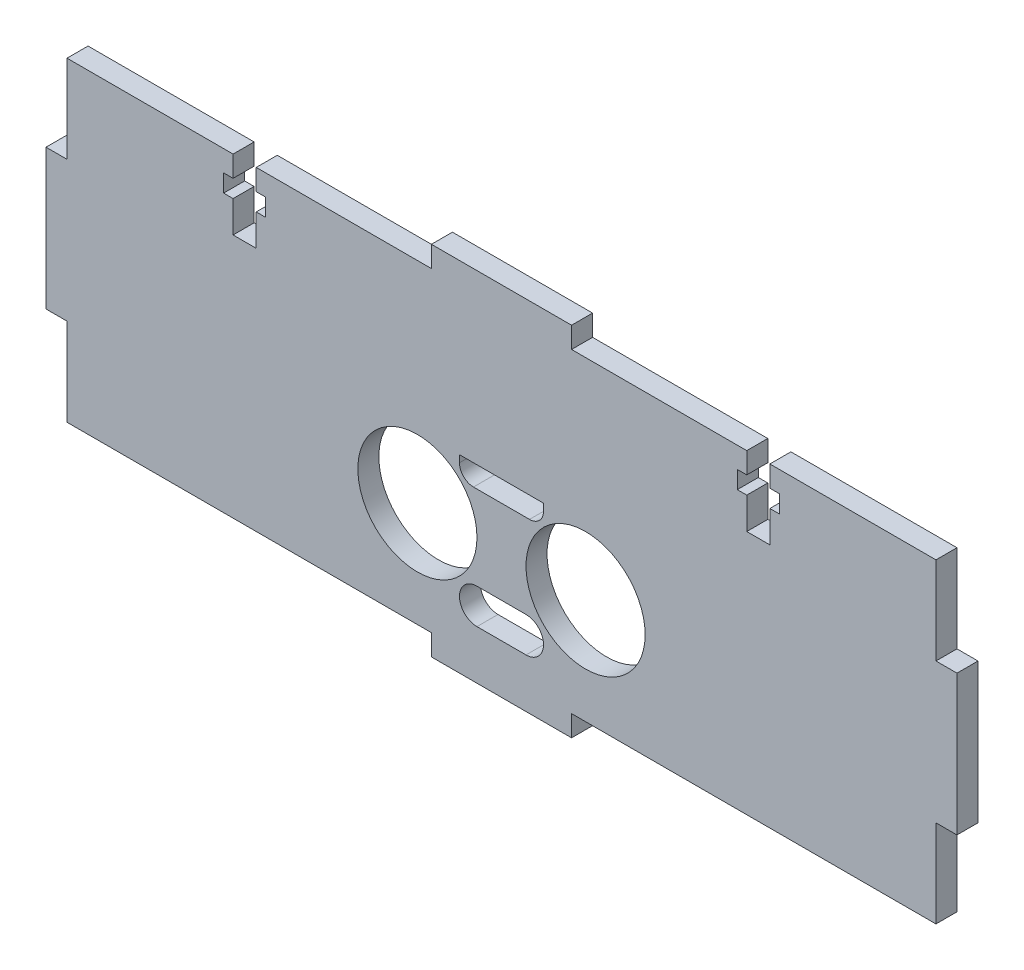
from build123d import *

# Parameters (mm, degrees)
SKETCH1_R           = 8.5
BOSS_EXTRUDE1_DEPTH = 3


with BuildPart() as part:
    # Sketch1 → Boss-Extrude1 (new body)
    with BuildSketch(Plane.XY):
        Polygon((10, -22.5), (62, -22.5), (62, -10), (65, -10), (65, 10), (62, 10), (62, 22.5), (38.3, 22.5), (38.3, 19.5), (39.65, 19.5), (39.65, 17), (38.3, 17), (38.3, 12.5), (35, 12.5), (35, 17), (33.65, 17), (33.65, 19.5), (35, 19.5), (35, 22.5), (10, 22.5), (10, 25.5), (-10, 25.5), (-10, 22.5), (-35, 22.5), (-35, 19.5), (-33.65, 19.5), (-33.65, 17), (-35, 17), (-35, 12.5), (-38.3, 12.5), (-38.3, 17), (-39.65, 17), (-39.65, 19.5), (-38.3, 19.5), (-38.3, 22.5), (-62, 22.5), (-62, 10), (-65, 10), (-65, -10), (-62, -10), (-62, -22.5), (-10, -22.5), (-10, -25.5), (10, -25.5), align=None)
        with Locations((-12, -7.5)):
            Circle(SKETCH1_R, mode=Mode.SUBTRACT)
        with BuildLine():
            ThreePointArc((-3.5, -18.5), (-6, -16), (-3.5, -13.5))
            Line((-3.5, -13.5), (3.5, -13.5))
            ThreePointArc((3.5, -13.5), (6, -16), (3.5, -18.5))
            Line((3.5, -18.5), (-3.5, -18.5))
        make_face(mode=Mode.SUBTRACT)
        with Locations((12, -7.5)):
            Circle(SKETCH1_R, mode=Mode.SUBTRACT)
        with BuildLine():
            ThreePointArc((6, 0.5), (5.414213562, -0.914213562), (4, -1.5))
            Line((4, -1.5), (-4, -1.5))
            ThreePointArc((-4, -1.5), (-5.414213562, -0.914213562), (-6, 0.5))
            Line((-6, 0.5), (-6, 1.5))
            Line((-6, 1.5), (6, 1.5))
            Line((6, 1.5), (6, 0.5))
        make_face(mode=Mode.SUBTRACT)
    extrude(amount=BOSS_EXTRUDE1_DEPTH)


solid = part.part
